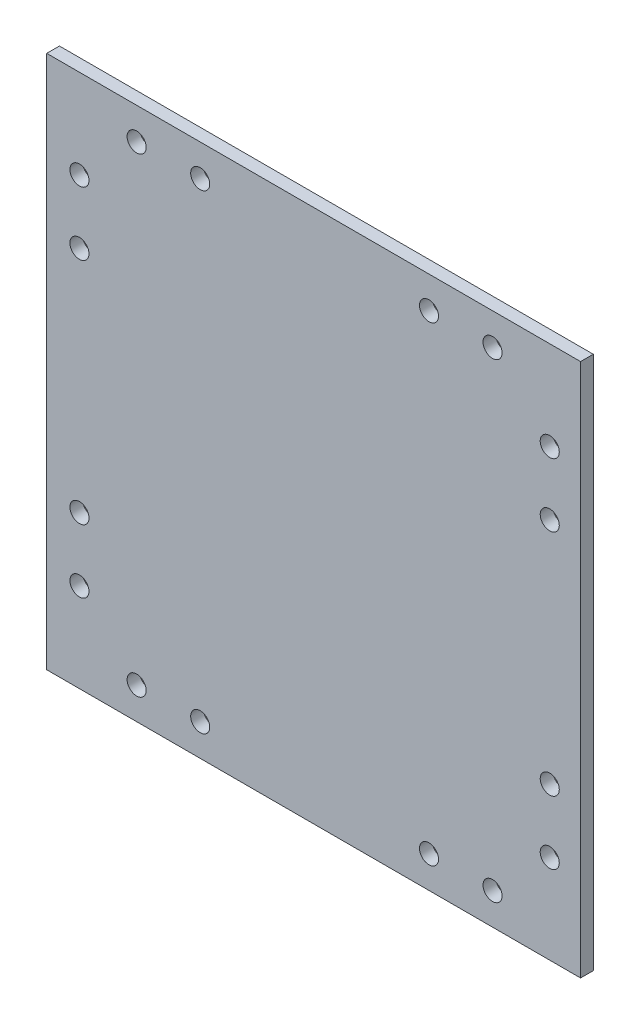
from build123d import *

# Parameters (mm, degrees)
SKETCH_1_W          = 84
SKETCH_1_H          = 84
EXTRUDE_1_DEPTH     = 2
SKETCH_2_R          = 1.5
CUT_EXTRUDE_1_DEPTH = 60.430631832


with BuildPart() as part:
    # 草图1 → 凸台-拉伸1 (new body)
    with BuildSketch(Plane.XY):
        Rectangle(SKETCH_1_W, SKETCH_1_H)
    extrude(amount=EXTRUDE_1_DEPTH)

    # 草图2 → 切除-拉伸1 (cut, through all)
    with BuildSketch(Plane.XY.offset(2)):
        with Locations((18.15, -37)):
            Circle(SKETCH_2_R)
        with Locations((28.15, -37)):
            Circle(SKETCH_2_R)
        with Locations((37.15, -28)):
            Circle(SKETCH_2_R)
        with Locations((37.15, -18)):
            Circle(SKETCH_2_R)
        with Locations((37.15, 18)):
            Circle(SKETCH_2_R)
        with Locations((37.15, 28)):
            Circle(SKETCH_2_R)
        with Locations((-17.85, -37)):
            Circle(SKETCH_2_R)
        with Locations((-27.85, -37)):
            Circle(SKETCH_2_R)
        with Locations((-36.85, -28)):
            Circle(SKETCH_2_R)
        with Locations((-36.85, -18)):
            Circle(SKETCH_2_R)
        with Locations((-36.85, 18)):
            Circle(SKETCH_2_R)
        with Locations((-36.85, 28)):
            Circle(SKETCH_2_R)
        with Locations((28.15, 37)):
            Circle(SKETCH_2_R)
        with Locations((18.15, 37)):
            Circle(SKETCH_2_R)
        with Locations((-17.85, 37)):
            Circle(SKETCH_2_R)
        with Locations((-27.85, 37)):
            Circle(SKETCH_2_R)
    extrude(amount=-CUT_EXTRUDE_1_DEPTH, mode=Mode.SUBTRACT)


solid = part.part
